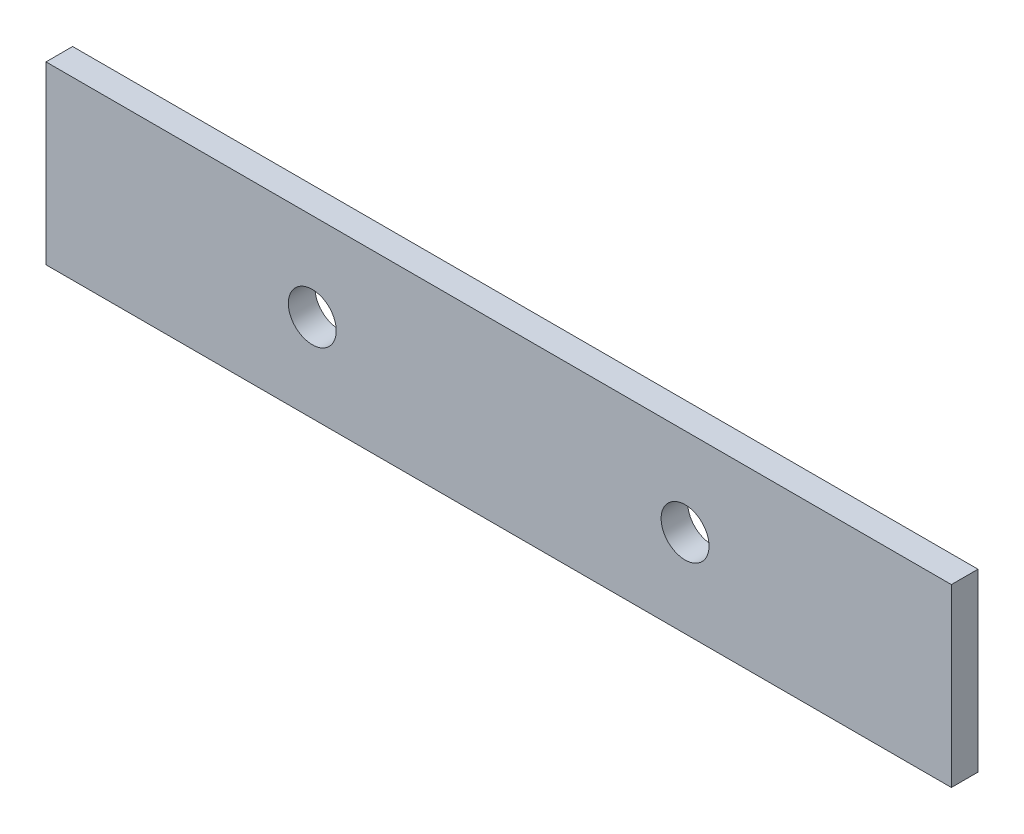
from build123d import *

# Parameters (mm, degrees)
SKETCH1_W           = 170
SKETCH1_H           = 5
BOSS_EXTRUDE1_DEPTH = 33
SKETCH2_R           = 4.5
CUT_EXTRUDE1_DEPTH  = 10


with BuildPart() as part:
    # Sketch1 → Boss-Extrude1 (new body)
    with BuildSketch(Plane(origin=(0, 0, 0), x_dir=(1, 0, 0), z_dir=(0, 1, 0))):
        with Locations((85, 2.5)):
            Rectangle(SKETCH1_W, SKETCH1_H)
    extrude(amount=BOSS_EXTRUDE1_DEPTH)

    # Sketch2 → Cut-Extrude1 (cut)
    with BuildSketch(Plane.XY):
        with Locations((50, 16.5)):
            Circle(SKETCH2_R)
        with Locations((120, 16.5)):
            Circle(SKETCH2_R)
    extrude(amount=-CUT_EXTRUDE1_DEPTH, mode=Mode.SUBTRACT)


solid = part.part
